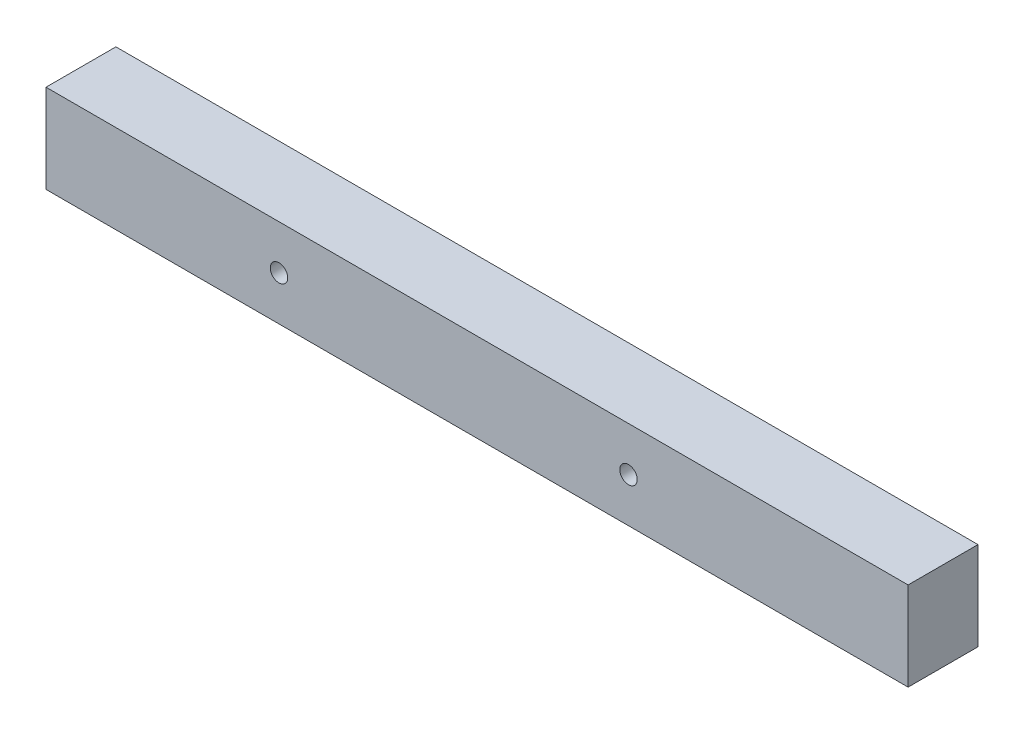
from build123d import *

# Parameters (mm, degrees)
SKETCH_2_W      = 37
SKETCH_2_H      = 3.8
SKETCH_2_R      = 0.375
EXTRUDE_1_DEPTH = 3


with BuildPart() as part:
    # 草图2 → 凸台-拉伸1 (new body)
    with BuildSketch(Plane.XY):
        with Locations((-18.5, 0)):
            Rectangle(SKETCH_2_W, SKETCH_2_H)
        with Locations((-12, 0)):
            Circle(SKETCH_2_R, mode=Mode.SUBTRACT)
        with Locations((-27, 0)):
            Circle(SKETCH_2_R, mode=Mode.SUBTRACT)
    extrude(amount=EXTRUDE_1_DEPTH)


solid = part.part
